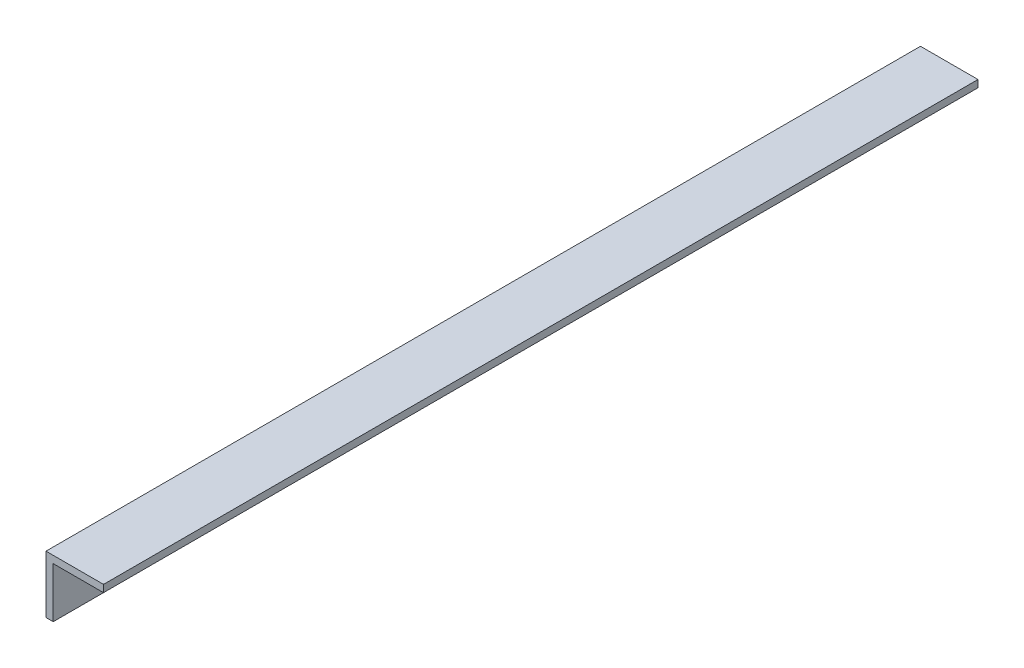
from build123d import *

# Parameters (mm, degrees)
BOSS_EXTRUDE1_DEPTH = 386.08
SKETCH2_R           = 3.96875
CUT_EXTRUDE1_DEPTH  = 6.35


with BuildPart() as part:
    # Sketch1 → Boss-Extrude1 (new body)
    with BuildSketch(Plane.XY):
        Polygon((0, 0), (0, 25.4), (25.4, 25.4), (25.4, 22.225), (3.175, 22.225), (3.175, 0), align=None)
    extrude(amount=BOSS_EXTRUDE1_DEPTH)

    # Sketch2 → Cut-Extrude1 (cut)
    with BuildSketch(Plane(origin=(3.175, 0, 0), x_dir=(0, 0, -1), z_dir=(1, 0, 0))):
        with Locations(Location((-367.03, 12.7, 0), (0, 0, 90))):
            Circle(SKETCH2_R)
        with Locations(Location((-227.33, 12.7, 0), (0, 0, 90))):
            Circle(SKETCH2_R)
    extrude(amount=-CUT_EXTRUDE1_DEPTH, mode=Mode.SUBTRACT)


solid = part.part
